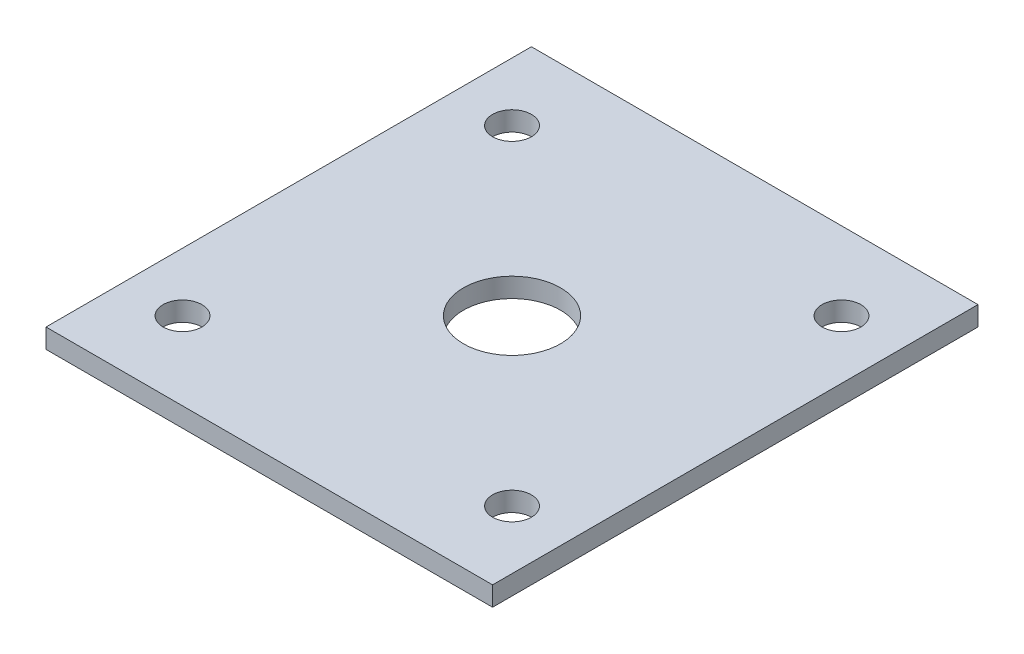
from build123d import *

# Parameters (mm, degrees)
SKETCH1_W           = 46
SKETCH1_H           = 50
BOSS_EXTRUDE1_DEPTH = 2
SKETCH2_R           = 5
CUT_EXTRUDE2_DEPTH  = 35.029399054
SKETCH3_R           = 2
CUT_EXTRUDE4_DEPTH  = 35.029399054


with BuildPart() as part:
    # Sketch1 → Boss-Extrude1 (new body)
    with BuildSketch(Plane(origin=(0, 0, 0), x_dir=(1, 0, 0), z_dir=(0, 1, 0))):
        Rectangle(SKETCH1_W, SKETCH1_H)
    extrude(amount=BOSS_EXTRUDE1_DEPTH)

    # Sketch2 → Cut-Extrude2 (cut, through all)
    with BuildSketch(Plane(origin=(0, 2, 0), x_dir=(1, 0, 0), z_dir=(0, 1, 0))):
        with Locations(Location((0, 0, 0), (0, 0, 270))):
            Circle(SKETCH2_R)
    extrude(amount=-CUT_EXTRUDE2_DEPTH, mode=Mode.SUBTRACT)

    # Sketch3 → Cut-Extrude4 (cut, through all)
    with BuildSketch(Plane(origin=(0, 2, 0), x_dir=(1, 0, 0), z_dir=(0, 1, 0))):
        with Locations(Location((-16.969271933, 16.969271933, 0), (0, 0, 270))):
            Circle(SKETCH3_R)
        with Locations(Location((16.969269724, 16.969269724, 0), (0, 0, 270))):
            Circle(SKETCH3_R)
        with Locations(Location((16.969269724, -16.969269724, 0), (0, 0, 270))):
            Circle(SKETCH3_R)
        with Locations(Location((-16.969268581, -16.969268581, 0), (0, 0, 270))):
            Circle(SKETCH3_R)
    extrude(amount=-CUT_EXTRUDE4_DEPTH, mode=Mode.SUBTRACT)


solid = part.part
